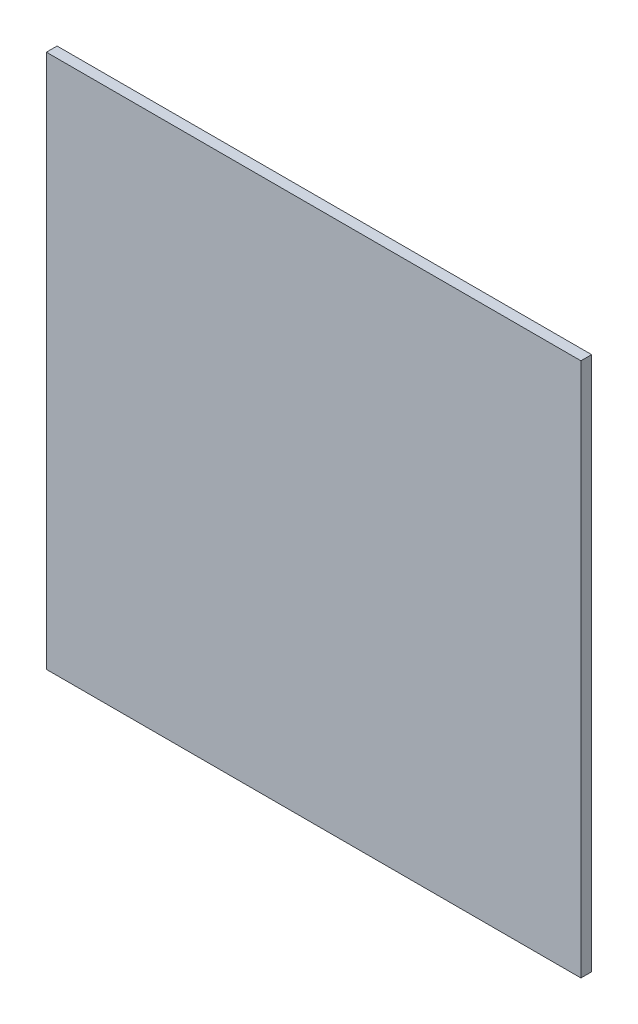
from build123d import *

# Parameters (mm, degrees)
SKETCH_1_W      = 250
SKETCH_1_H      = 250
EXTRUDE_1_DEPTH = 5


with BuildPart() as part:
    # 草图1 → 凸台-拉伸1 (new body)
    with BuildSketch(Plane.XY):
        with Locations((125, 125)):
            Rectangle(SKETCH_1_W, SKETCH_1_H)
    extrude(amount=EXTRUDE_1_DEPTH)


solid = part.part
